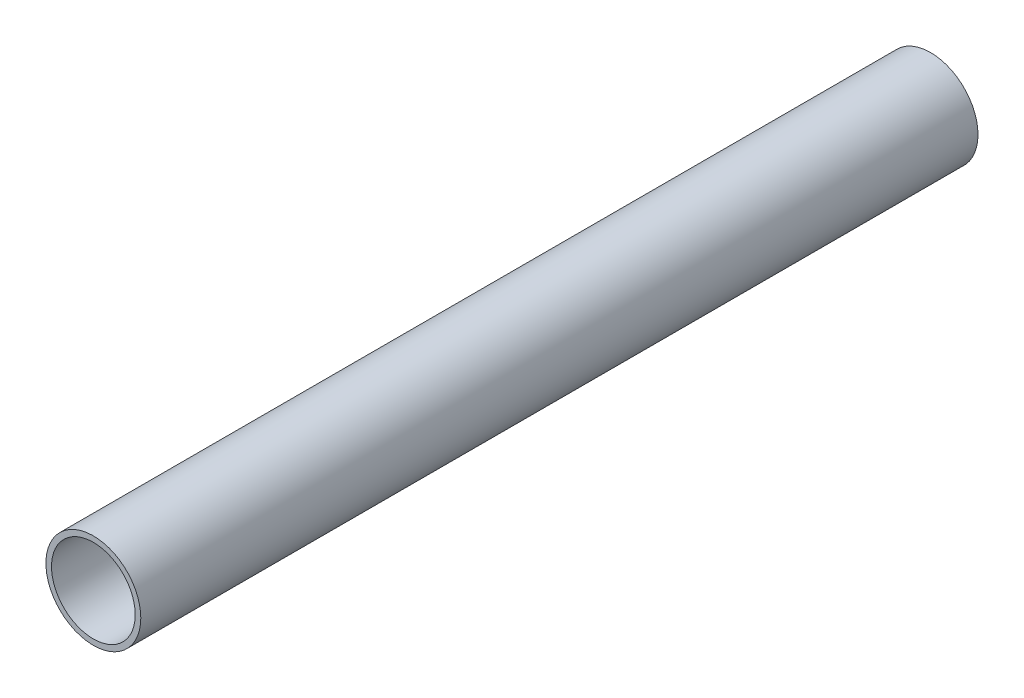
from build123d import *

# Parameters (mm, degrees)
SKETCH1_R           = 17
SKETCH1_R_2         = 15
BOSS_EXTRUDE1_DEPTH = 150


with BuildPart() as part:
    # Sketch1 → Boss-Extrude1 (new, symmetric)
    with BuildSketch(Plane.XY):
        Circle(SKETCH1_R)
        Circle(SKETCH1_R_2, mode=Mode.SUBTRACT)
    extrude(amount=BOSS_EXTRUDE1_DEPTH, both=True)


solid = part.part
